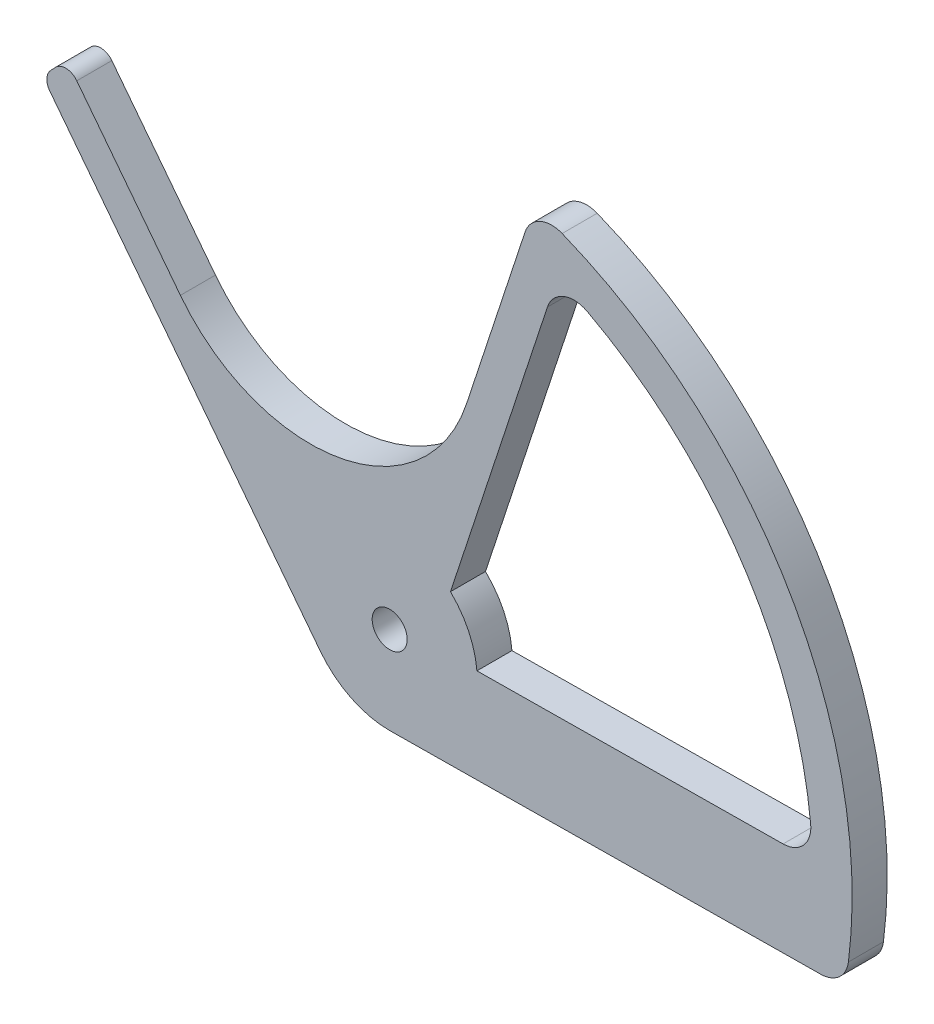
from build123d import *

# Parameters (mm, degrees)
SKETCH1_R           = 3.175
BOSS_EXTRUDE1_DEPTH = 6.35
FILLET1_R           = 5.08
FILLET2_R           = 2.54


with BuildPart() as part:
    # Sketch1 → Boss-Extrude1 (new body)
    with BuildSketch(Plane.XY):
        with BuildLine():
            Line((-12.557727148, -9.711802813), (-62.907969157, 55.392958186))
            ThreePointArc((-62.907969157, 55.392958186), (-60.738998149, 57.76302021), (-58.480795155, 60.048222272))
            Line((-58.480795155, 60.048222272), (-37.93049883, 33.475914427))
            ThreePointArc((-37.93049883, 33.475914427), (-9.314173502, 22.341362046), (13.936413388, 42.398344403))
            Line((13.936413388, 42.398344403), (26.174060388, 79.628581318))
            ThreePointArc((26.174060388, 79.628581318), (72.040987894, 42.847269029), (82.4642609, -15.014595376))
            Line((82.4642609, -15.014595376), (0, -15.875))
            ThreePointArc((0, -15.875), (-6.994310379, -14.251148983), (-12.557727148, -9.711802813))
        make_face()
        Circle(SKETCH1_R, mode=Mode.SUBTRACT)
        with BuildLine():
            Line((30.398061223, 70.395411405), (11.01621883, 11.430596996))
            ThreePointArc((11.01621883, 11.430596996), (14.320406292, 6.851393189), (15.812676769, 1.405303663))
            Line((15.812676769, 1.405303663), (76.65111989, 2.04007171))
            ThreePointArc((76.65111989, 2.04007171), (63.505865166, 42.971632067), (30.398061223, 70.395411405))
        make_face(mode=Mode.SUBTRACT)
    extrude(amount=BOSS_EXTRUDE1_DEPTH)

    # Fillet1
    fillet1_edges = [part.edges().sort_by_distance(p)[0] for p in [
        (76.65111989, 2.04007171, 3.175),
        (30.398061223, 70.395411405, 3.175),
        (26.174060388, 79.628581318, 3.175),
        (82.4642609, -15.014595376, 3.175),
    ]]
    fillet(fillet1_edges, radius=FILLET1_R)

    # Fillet2
    fillet2_edges = [part.edges().sort_by_distance(p)[0] for p in [
        (-62.907969157, 55.392958186, 3.175),
        (-58.480795155, 60.048222272, 3.175),
    ]]
    fillet(fillet2_edges, radius=FILLET2_R)


solid = part.part
